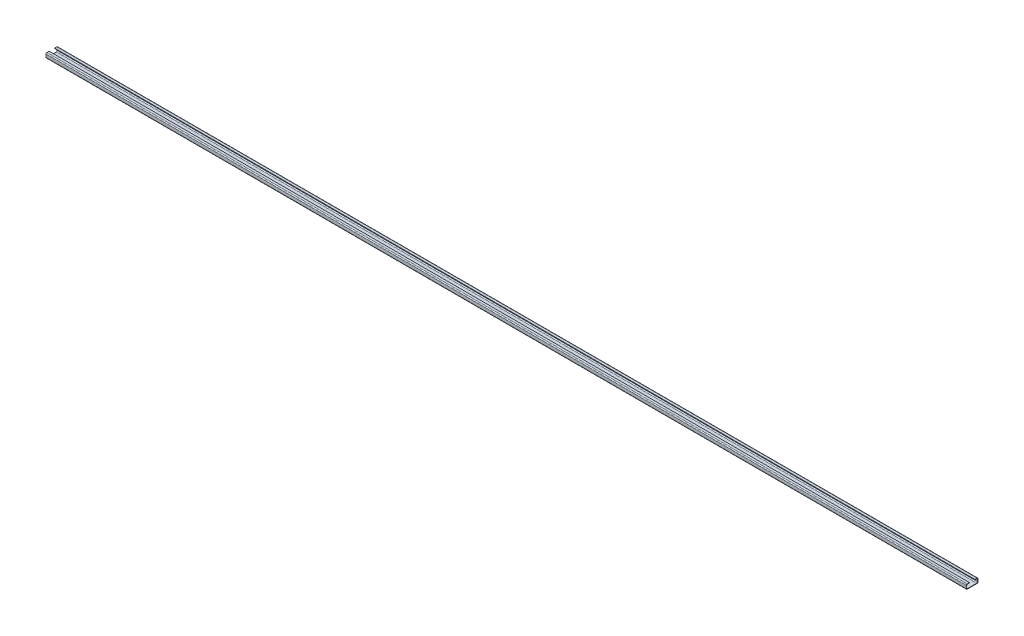
from build123d import *

# Parameters (mm, degrees)
RESSALTO_EXTRUS_O1_DEPTH = 5900
FILETE1_R                = 6


with BuildPart() as part:
    # Esboço1 → Ressalto-extrusão1 (new body)
    with BuildSketch(Plane(origin=(0, 0, 0), x_dir=(0, 0, -1), z_dir=(1, 0, 0))):
        Polygon((-34.75, 12.25), (-34.75, -12.25), (34.75, -12.25), (34.75, 12.25), (17.5, 12.25), (17.5, 15), (37.5, 15), (37.5, -15), (-37.5, -15), (-37.5, 15), (-17.5, 15), (-17.5, 12.25), align=None)
    extrude(amount=RESSALTO_EXTRUS_O1_DEPTH)

    # Filete1
    filete1_edges = [part.edges().sort_by_distance(p)[0] for p in [
        (2950, -15, -37.5),
        (2950, -15, 37.5),
        (2950, 15, 37.5),
        (2950, 12.25, 34.75),
        (2950, -12.25, 34.75),
        (2950, -12.25, -34.75),
        (2950, 12.25, -34.75),
        (2950, 15, -37.5),
    ]]
    fillet(filete1_edges, radius=FILETE1_R)


solid = part.part
